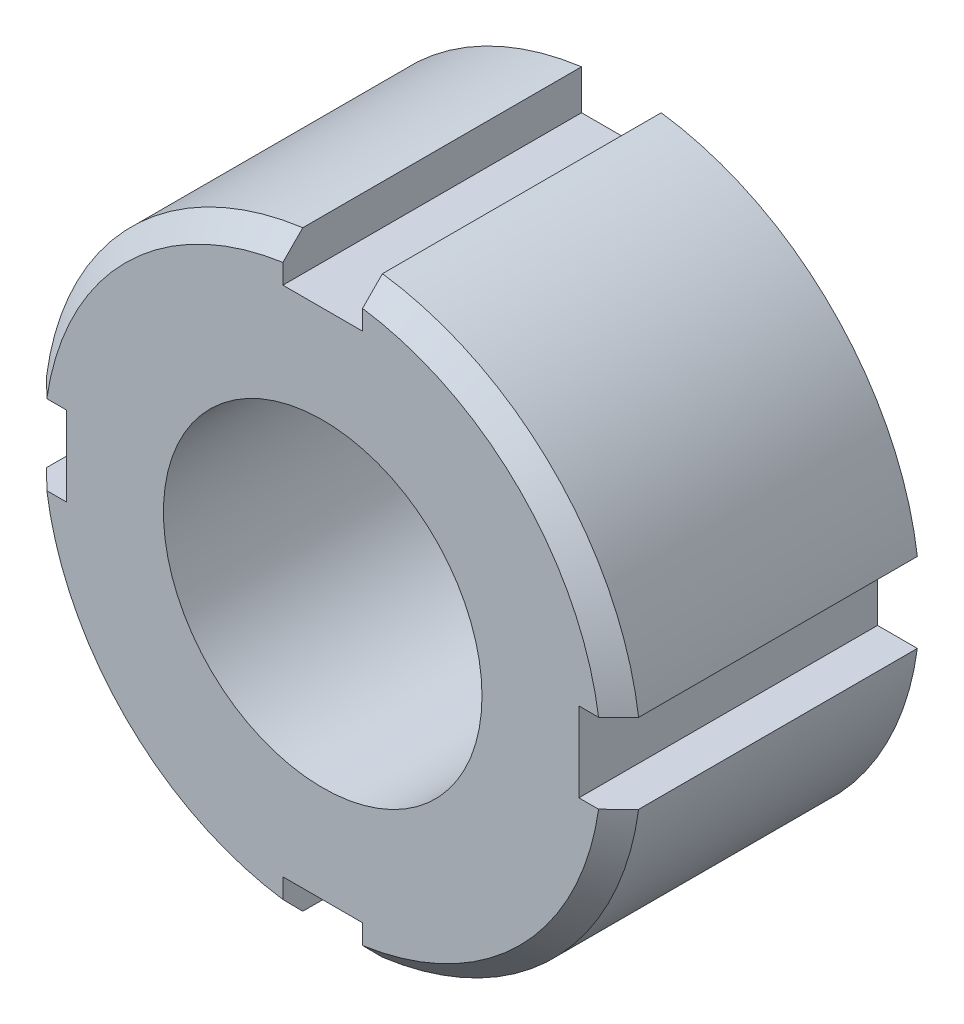
from build123d import *

# Parameters (mm, degrees)
SKETCH1_R           = 15
BOSS_EXTRUDE1_DEPTH = 15
CUT_EXTRUDE1_DEPTH  = 26.980762114
SKETCH3_R           = 8
CUT_EXTRUDE2_DEPTH  = 26.82634314
CHAMFER1_SIZE       = 1


with BuildPart() as part:
    # Sketch1 → Boss-Extrude1 (new body)
    with BuildSketch(Plane.XY):
        Circle(SKETCH1_R)
    extrude(amount=BOSS_EXTRUDE1_DEPTH)

    # Sketch2 → Cut-Extrude1 (cut, through all)
    with BuildSketch(Plane.XY.offset(15)):
        with BuildLine():
            Line((-2, 14.866068747), (-2, 12.866068747))
            Line((-2, 12.866068747), (2, 12.866068747))
            Line((2, 12.866068747), (2, 14.866068747))
            ThreePointArc((2, 14.866068747), (0, 15), (-2, 14.866068747))
        make_face()
        with BuildLine():
            Line((14.866068747, 2), (12.866068747, 2))
            Line((12.866068747, 2), (12.866068747, -2))
            Line((12.866068747, -2), (14.866068747, -2))
            ThreePointArc((14.866068747, -2), (15, 0), (14.866068747, 2))
        make_face()
        with BuildLine():
            Line((2, -14.866068747), (2, -12.866068747))
            Line((2, -12.866068747), (-2, -12.866068747))
            Line((-2, -12.866068747), (-2, -14.866068747))
            ThreePointArc((-2, -14.866068747), (0, -15), (2, -14.866068747))
        make_face()
        with BuildLine():
            Line((-14.866068747, -2), (-12.866068747, -2))
            Line((-12.866068747, -2), (-12.866068747, 2))
            Line((-12.866068747, 2), (-14.866068747, 2))
            ThreePointArc((-14.866068747, 2), (-15, 0), (-14.866068747, -2))
        make_face()
    extrude(amount=-CUT_EXTRUDE1_DEPTH, mode=Mode.SUBTRACT)

    # Sketch3 → Cut-Extrude2 (cut, through all)
    with BuildSketch(Plane.XY.offset(15)):
        Circle(SKETCH3_R)
    extrude(amount=-CUT_EXTRUDE2_DEPTH, mode=Mode.SUBTRACT)

    # Chamfer1
    chamfer1_edges = [part.edges().sort_by_distance(p)[0] for p in [
        (-10.606601718, 10.606601718, 15),
        (-10.606601718, -10.606601718, 15),
        (10.606601718, -10.606601718, 15),
        (10.606601718, 10.606601718, 15),
    ]]
    chamfer(chamfer1_edges, length=CHAMFER1_SIZE)


solid = part.part
